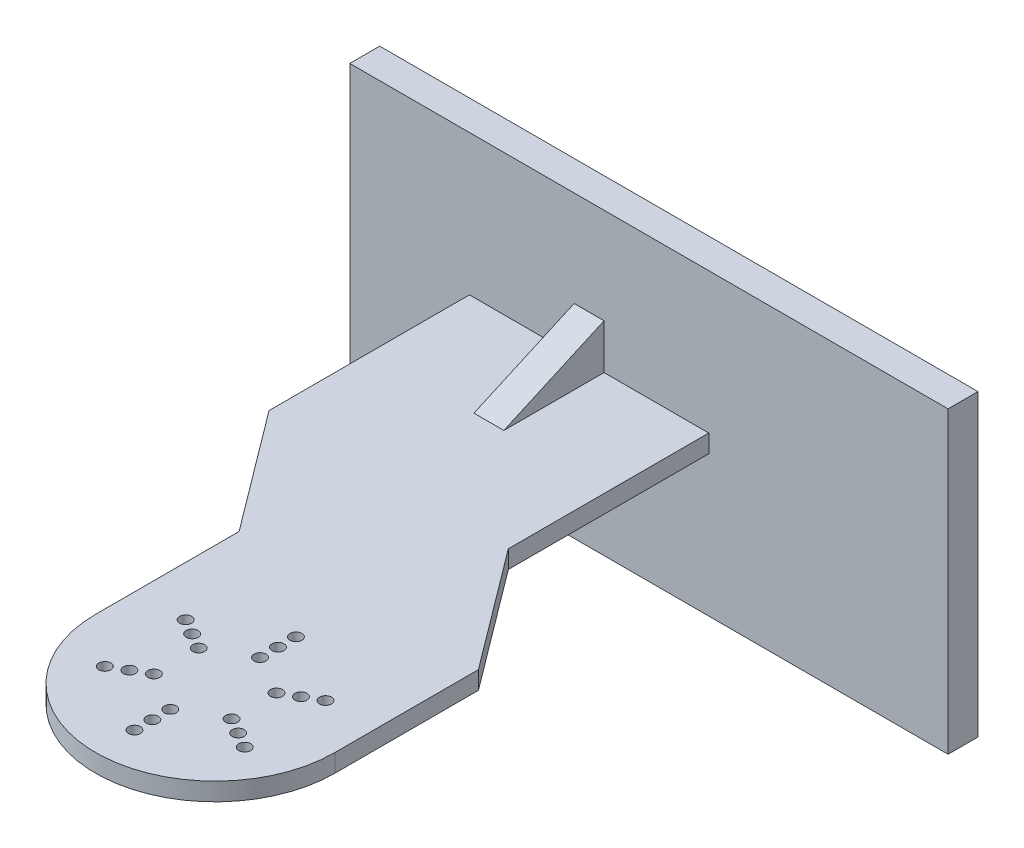
from build123d import *

# Parameters (mm, degrees)
SKETCH1_R                = 1
BOSS_EXTRUDE1_DEPTH      = 1.5
BOSS_EXTRUDE2_DEPTH      = 2.5
BOSS_EXTRUDE3_DEPTH      = 60
BOSS_EXTRUDE3_DEPTH_BACK = 40
SKETCH4_W                = 5
SKETCH4_H                = 50


with BuildPart() as part:
    # Sketch1 → Boss-Extrude1 (new, symmetric)
    with BuildSketch(Plane(origin=(0, 0, 0), x_dir=(1, 0, 0), z_dir=(0, 1, 0))):
        with BuildLine():
            Line((5, 77.5), (-35, 77.5))
            Line((-35, 77.5), (-35, 44))
            Line((-35, 44), (-20, 24))
            Line((-20, 24), (-20, 0))
            ThreePointArc((-20, 0), (0, -20), (20, 0))
            Line((20, 0), (20, 24))
            Line((20, 24), (5, 44))
            Line((5, 44), (5, 77.5))
        make_face()
        with Locations(Location((0, 7.5, 0), (0, 0, 270))):
            Circle(SKETCH1_R, mode=Mode.SUBTRACT)
        with Locations(Location((0, 10.5, 0), (0, 0, 270))):
            Circle(SKETCH1_R, mode=Mode.SUBTRACT)
        with Locations(Location((0, 13.5, 0), (0, 0, 270))):
            Circle(SKETCH1_R, mode=Mode.SUBTRACT)
        with Locations(Location((11.691342951, 6.75, 0), (0, 0, 270))):
            Circle(SKETCH1_R, mode=Mode.SUBTRACT)
        with Locations(Location((6.495190528, 3.75, 0), (0, 0, 270))):
            Circle(SKETCH1_R, mode=Mode.SUBTRACT)
        with Locations(Location((9.09326674, 5.25, 0), (0, 0, 270))):
            Circle(SKETCH1_R, mode=Mode.SUBTRACT)
        with Locations(Location((11.691342951, -6.75, 0), (0, 0, 270))):
            Circle(SKETCH1_R, mode=Mode.SUBTRACT)
        with Locations(Location((6.495190528, -3.75, 0), (0, 0, 270))):
            Circle(SKETCH1_R, mode=Mode.SUBTRACT)
        with Locations(Location((9.09326674, -5.25, 0), (0, 0, 270))):
            Circle(SKETCH1_R, mode=Mode.SUBTRACT)
        with Locations(Location((0, -13.5, 0), (0, 0, 270))):
            Circle(SKETCH1_R, mode=Mode.SUBTRACT)
        with Locations(Location((0, -7.5, 0), (0, 0, 270))):
            Circle(SKETCH1_R, mode=Mode.SUBTRACT)
        with Locations(Location((0, -10.5, 0), (0, 0, 270))):
            Circle(SKETCH1_R, mode=Mode.SUBTRACT)
        with Locations(Location((-11.691342951, -6.75, 0), (0, 0, 270))):
            Circle(SKETCH1_R, mode=Mode.SUBTRACT)
        with Locations(Location((-6.495190528, -3.75, 0), (0, 0, 270))):
            Circle(SKETCH1_R, mode=Mode.SUBTRACT)
        with Locations(Location((-9.09326674, -5.25, 0), (0, 0, 270))):
            Circle(SKETCH1_R, mode=Mode.SUBTRACT)
        with Locations(Location((-11.691342951, 6.75, 0), (0, 0, 270))):
            Circle(SKETCH1_R, mode=Mode.SUBTRACT)
        with Locations(Location((-6.495190528, 3.75, 0), (0, 0, 270))):
            Circle(SKETCH1_R, mode=Mode.SUBTRACT)
        with Locations(Location((-9.09326674, 5.25, 0), (0, 0, 270))):
            Circle(SKETCH1_R, mode=Mode.SUBTRACT)
    extrude(amount=BOSS_EXTRUDE1_DEPTH, both=True)

    # Sketch3 → Boss-Extrude2 (add, symmetric)
    with BuildSketch(Plane(origin=(-15, 0, 0), x_dir=(0, 0, -1), z_dir=(1, 0, 0))):
        Polygon((60.75, 1.5), (77.5, 9), (77.5, 1.5), align=None)
    boss_extrude2 = extrude(amount=BOSS_EXTRUDE2_DEPTH, both=True)

    # Mirror1: Boss-Extrude2 across plane
    add(boss_extrude2.mirror(Plane.ZX))

    # Sketch4 → Boss-Extrude3 (add, two sides: drawn at the far end of the back side and taken through both)
    with BuildSketch(Plane(origin=(-15, 0, 0), x_dir=(0, 0, -1), z_dir=(1, 0, 0)).offset(-BOSS_EXTRUDE3_DEPTH_BACK)):
        with Locations((80, 0)):
            Rectangle(SKETCH4_W, SKETCH4_H)
    extrude(amount=BOSS_EXTRUDE3_DEPTH + BOSS_EXTRUDE3_DEPTH_BACK)


solid = part.part
